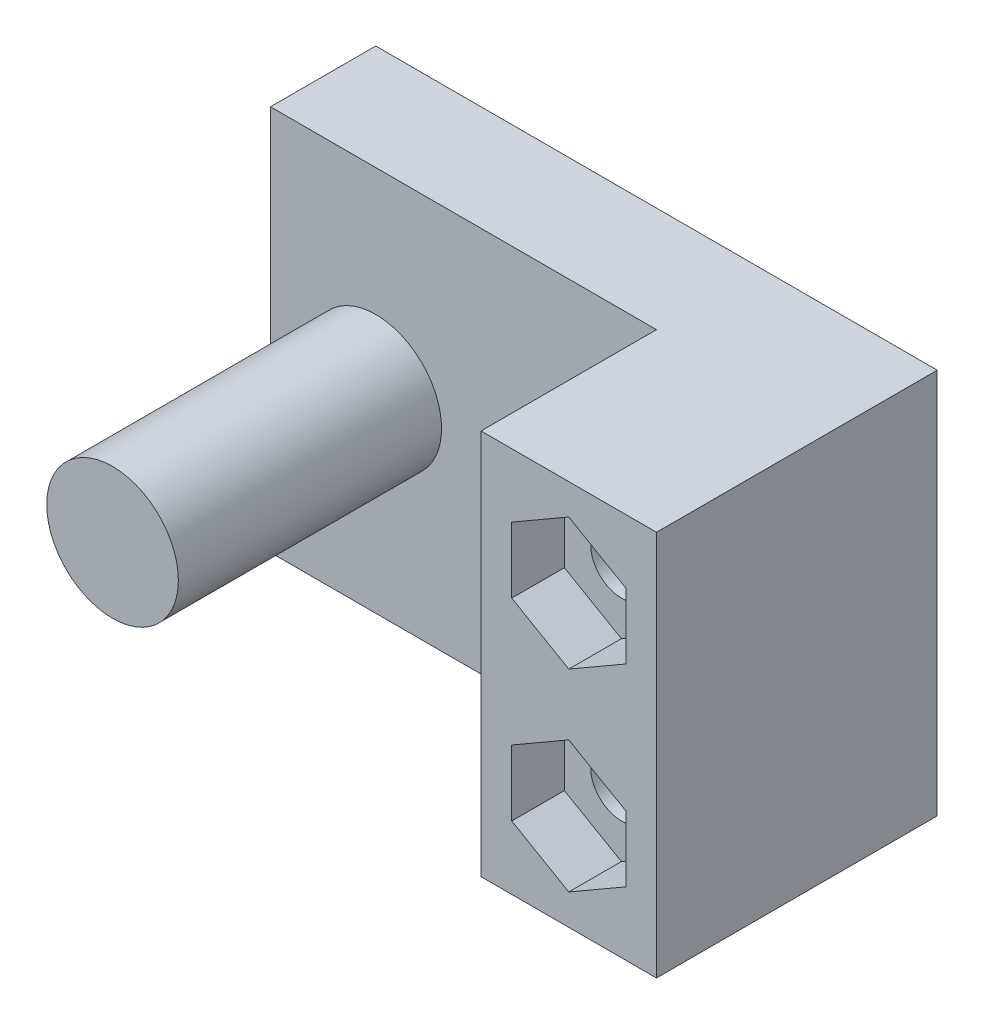
from build123d import *

# Parameters (mm, degrees)
BOSS_EXTRUDE1_DEPTH = 22
SKETCH3_R           = 3.75
BOSS_EXTRUDE2_DEPTH = 15
SKETCH7_R           = 1.75
CUT_EXTRUDE3_DEPTH  = 6
CUT_EXTRUDE4_DEPTH  = 3


with BuildPart() as part:
    # Sketch2 → Boss-Extrude1 (new body)
    with BuildSketch(Plane(origin=(0, 0, 0), x_dir=(1, 0, 0), z_dir=(0, 1, 0))):
        Polygon((23, 0), (-9, 0), (-9, -6), (13, -6), (13, -16), (23, -16), align=None)
    extrude(amount=BOSS_EXTRUDE1_DEPTH)

    # Sketch3 → Boss-Extrude2 (add)
    with BuildSketch(Plane.XY.offset(6)):
        with Locations(Location((-3, 11, 0), (0, 0, 180))):
            Circle(SKETCH3_R)
    extrude(amount=BOSS_EXTRUDE2_DEPTH)

    # Sketch7 → Cut-Extrude3 (cut)
    with BuildSketch(Plane.XY.offset(16)):
        with Locations((18, 16.5)):
            Circle(SKETCH7_R)
        with Locations((18, 5.5)):
            Circle(SKETCH7_R)
    extrude(amount=-CUT_EXTRUDE3_DEPTH, mode=Mode.SUBTRACT)

    # Sketch8 → Cut-Extrude4 (cut)
    with BuildSketch(Plane.XY.offset(16)):
        Polygon((21.25, 14.623611625), (21.25, 18.376388375), (18, 20.25277675), (14.75, 18.376388375), (14.75, 14.623611625), (18, 12.74722325), align=None)
        Polygon((21.25, 3.623611625), (21.25, 7.376388375), (18, 9.25277675), (14.75, 7.376388375), (14.75, 3.623611625), (18, 1.74722325), align=None)
    extrude(amount=-CUT_EXTRUDE4_DEPTH, mode=Mode.SUBTRACT)


solid = part.part
